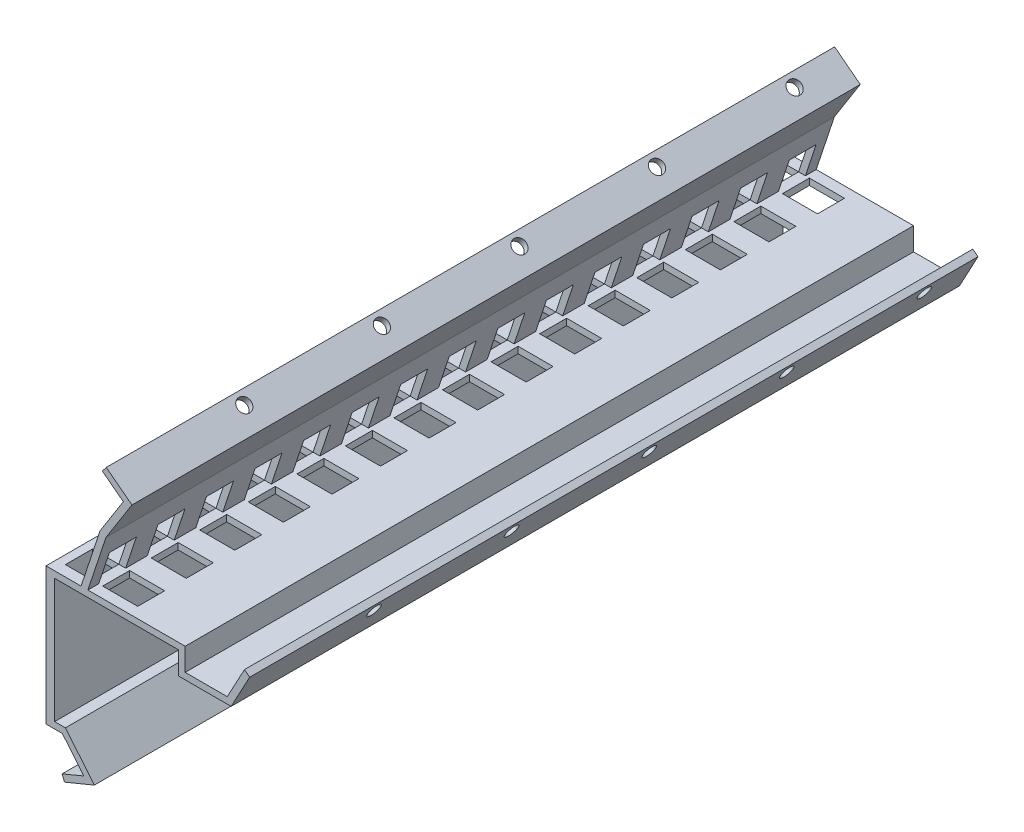
from build123d import *

# Parameters (mm, degrees)
BOSS_EXTRUDE1_DEPTH = 85.5
SKETCH2_W           = 5
SKETCH2_H           = 9
CUT_EXTRUDE1_DEPTH  = 15
LPATTERN2_COUNT     = 19
LPATTERN2_PITCH     = 9
SKETCH3_R           = 1.25
CUT_EXTRUDE2_DEPTH  = 12
SKETCH4_R           = 1.25
CUT_EXTRUDE3_DEPTH  = 12
SKETCH5_R           = 1.25
CUT_EXTRUDE4_DEPTH  = 5
LPATTERN3_COUNT     = 7
LPATTERN3_PITCH     = 25.5
BOSS_EXTRUDE2_START = -169
SKETCH6_W           = 2
SKETCH6_H           = 1.2
SKETCH6_W_2         = 1.6
SKETCH6_H_2         = 3
BOSS_EXTRUDE2_DEPTH = 167
SKETCH7_W           = 74.839862747
SKETCH7_H           = 61.845638487
CUT_EXTRUDE5_DEPTH  = 36


with BuildPart() as part:
    # Sketch1 → Boss-Extrude1 (new, symmetric)
    with BuildSketch(Plane.XY):
        Polygon((0, 0), (2, 0), (7.358048747, -6.520004744), (1.813345586, -8.816695993), (1.389781294, -7.693271427), (5.402946391, -6.030964015), (1.432927702, -1.2), (-1.6, -1.2), (-1.6, 24.2), (4.9, 24.2), (8.423371334, 34.850859927), (12.729886988, 41.653523698), (8.839638939, 44.638616016), (9.570152654, 45.590640024), (14.330272695, 41.93807145), (9.51627051, 34.333771156), (6.163955388, 24.2), (24.2, 24.2), (24.2, 20), (31.997124555, 20), (35.182829163, 25.937342104), (36.147489553, 25.197132153), (32.715082759, 18.8), (23, 18.8), (23, 23), (0, 23), align=None)
    extrude(amount=BOSS_EXTRUDE1_DEPTH, both=True)

    # Sketch2 → Cut-Extrude1 (cut)
    with BuildSketch(Plane.ZY.offset(1.6)):
        with Locations((81, 25.7)):
            Rectangle(SKETCH2_W, SKETCH2_H)
    cut_extrude1 = extrude(amount=-CUT_EXTRUDE1_DEPTH, mode=Mode.SUBTRACT)

    # LPattern2: Cut-Extrude1 ×19
    with Locations(*[(0, 0, -i * LPATTERN2_PITCH) for i in range(1, LPATTERN2_COUNT)]):
        add(cut_extrude1, mode=Mode.SUBTRACT)

    # Sketch3 → Cut-Extrude2 (cut)
    with BuildSketch(Plane(origin=(2.923510956, -7.0579798, 0), x_dir=(0.9238795325112892, 0.3826834323650841, 0), z_dir=(-0.38268343236508406, 0.9238795325112891, 0))):
        with Locations(Location((0.339902976, -76.5, 0), (0, 0, 180))):
            Circle(SKETCH3_R)
    cut_extrude2 = extrude(amount=-CUT_EXTRUDE2_DEPTH, mode=Mode.SUBTRACT)

    # Sketch4 → Cut-Extrude3 (cut)
    with BuildSketch(Plane(origin=(24.834682045, 32.365187767, 0), x_dir=(0.7933533402912303, -0.6087614290087271, 0), z_dir=(-0.6087614290087271, -0.7933533402912303, 0))):
        with Locations((-18.161310596, 76.5)):
            Circle(SKETCH4_R)
    cut_extrude3 = extrude(amount=-CUT_EXTRUDE3_DEPTH, mode=Mode.SUBTRACT)

    # Sketch5 → Cut-Extrude4 (cut)
    with BuildSketch(Plane(origin=(17.569718246, -9.427102465, 0), x_dir=(0, 0, -1), z_dir=(0.8811717857655161, -0.47279623937888016, 0))):
        with Locations(Location((-76.5, 37.293399059, 0), (0, 0, 90))):
            Circle(SKETCH5_R)
    cut_extrude4 = extrude(amount=-CUT_EXTRUDE4_DEPTH, mode=Mode.SUBTRACT)

    # LPattern3: Cut-Extrude2, Cut-Extrude3, Cut-Extrude4 ×7
    with Locations(*[(0, 0, -i * LPATTERN3_PITCH) for i in range(1, LPATTERN3_COUNT)]):
        add(cut_extrude2, mode=Mode.SUBTRACT)
        add(cut_extrude3, mode=Mode.SUBTRACT)
        add(cut_extrude4, mode=Mode.SUBTRACT)

    # Sketch6 → Boss-Extrude2 (add)
    with BuildSketch(Plane.XY.offset(85.5).offset(BOSS_EXTRUDE2_START)):
        with Locations((5.9, 23.6)):
            Rectangle(SKETCH6_W, SKETCH6_H)
        with Locations((-0.8, 22.7)):
            Rectangle(SKETCH6_W_2, SKETCH6_H_2)
    extrude(amount=BOSS_EXTRUDE2_DEPTH)

    # Sketch7 → Cut-Extrude5 (cut)
    with BuildSketch(Plane.XY.offset(85.5)):
        with Locations((11.925303278, 18.343728627)):
            Rectangle(SKETCH7_W, SKETCH7_H)
    extrude(amount=-CUT_EXTRUDE5_DEPTH, mode=Mode.SUBTRACT)


solid = part.part
